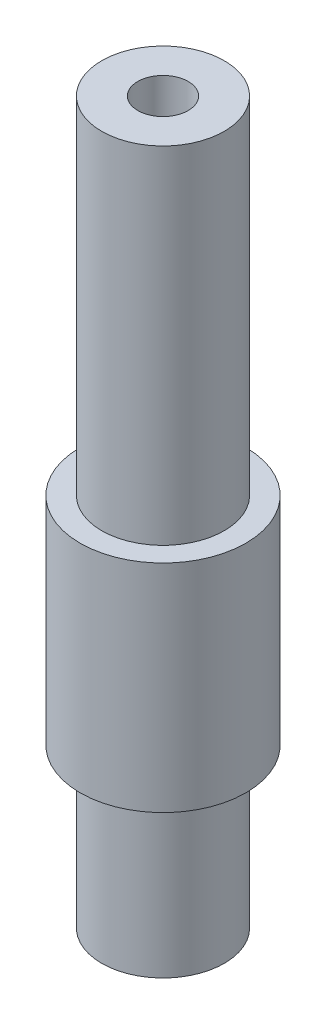
from build123d import *

# Parameters (mm, degrees)
SKETCH_1_R          = 8.5
EXTRUDE_1_DEPTH     = 22
SKETCH_2_R          = 11.5
EXTRUDE_2_DEPTH     = 30
SKETCH_3_R          = 8.5
EXTRUDE_3_DEPTH     = 48
CUT_EXTRUDE_START   = -5.5
CUT_EXTRUDE_1_DEPTH = 48
CUT_EXTRUDE_2_DEPTH = 5.5
M8X1_0_1_D          = 7
M8X1_0_1_DEPTH      = 18
M8X1_0_1_TIP        = 2.103012167


with BuildPart() as part:
    # 草图1 → 凸台-拉伸1 (new body)
    with BuildSketch(Plane(origin=(0, 0, 0), x_dir=(1, 0, 0), z_dir=(0, 1, 0))):
        with Locations(Location((0, 0, 0), (0, 0, 270))):
            Circle(SKETCH_1_R)
    extrude(amount=EXTRUDE_1_DEPTH)

    # 草图2 → 凸台-拉伸2 (add)
    with BuildSketch(Plane(origin=(0, 22, 0), x_dir=(1, 0, 0), z_dir=(0, 1, 0))):
        with Locations(Location((0, 0, 0), (0, 0, 270))):
            Circle(SKETCH_2_R)
    extrude(amount=EXTRUDE_2_DEPTH)

    # 草图3 → 凸台-拉伸3 (add)
    with BuildSketch(Plane(origin=(0, 52, 0), x_dir=(1, 0, 0), z_dir=(0, 1, 0))):
        with Locations(Location((0, 0, 0), (0, 0, 270))):
            Circle(SKETCH_3_R)
    extrude(amount=EXTRUDE_3_DEPTH)

    # 草图4 → 切除-拉伸1 (cut)
    with BuildSketch(Plane(origin=(0, 0, 0), x_dir=(0, 0, -1), z_dir=(1, 0, 0)).offset(CUT_EXTRUDE_START)):
        with BuildLine():
            Line((2.5, 17.5), (2.5, 4.5))
            ThreePointArc((2.5, 4.5), (0, 2), (-2.5, 4.5))
            Line((-2.5, 4.5), (-2.5, 17.5))
            ThreePointArc((-2.5, 17.5), (0, 20), (2.5, 17.5))
        make_face()
    extrude(amount=-CUT_EXTRUDE_1_DEPTH, mode=Mode.SUBTRACT)

    # 草图5 → 切除-拉伸2 (cut)
    with BuildSketch(Plane(origin=(0, 0, 0), x_dir=(0, 0, -1), z_dir=(1, 0, 0)).offset(CUT_EXTRUDE_START)):
        with BuildLine():
            Line((2.5, 96), (2.5, 87.133575026))
            ThreePointArc((2.5, 87.133575026), (0, 84.633575026), (-2.5, 87.133575026))
            Line((-2.5, 87.133575026), (-2.5, 96))
            ThreePointArc((-2.5, 96), (0, 98.5), (2.5, 96))
        make_face()
    extrude(amount=-CUT_EXTRUDE_2_DEPTH, mode=Mode.SUBTRACT)

    # M8x1.0 螺纹孔1
    with Locations(Plane(origin=(0, 100, 0), x_dir=(1, 0, 0), z_dir=(0, 1, 0))):
        with Locations((0, 0)):
            Hole(M8X1_0_1_D / 2, depth=M8X1_0_1_DEPTH)
            with Locations((0, 0, -(M8X1_0_1_DEPTH + M8X1_0_1_TIP / 2))):  # 118° drill point
                Cone(0, M8X1_0_1_D / 2, M8X1_0_1_TIP, mode=Mode.SUBTRACT)


solid = part.part
